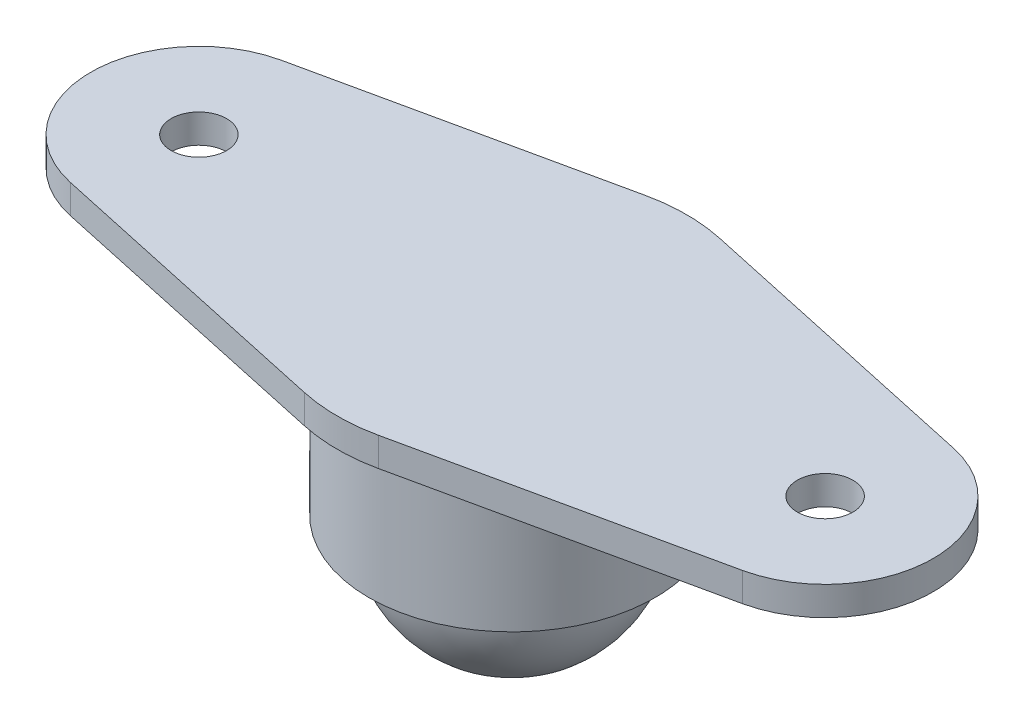
from build123d import *

# Parameters (mm, degrees)
SKETCH1_R           = 1.925
BOSS_EXTRUDE1_DEPTH = 2
SKETCH3_R           = 9.925
SKETCH3_R_2         = 7.925
BOSS_EXTRUDE2_DEPTH = 10


with BuildPart() as part:
    # Sketch1 → Boss-Extrude1 (new body)
    with BuildSketch(Plane(origin=(0, 0, 0), x_dir=(1, 0, 0), z_dir=(0, 1, 0))):
        with BuildLine():
            Line((-23.311850829, 7.329120748), (-2.570308471, 11.834086968))
            ThreePointArc((-2.570308471, 11.834086968), (0, 12.11), (2.570308471, 11.834086968))
            Line((2.570308471, 11.834086968), (23.311850829, 7.329120748))
            ThreePointArc((23.311850829, 7.329120748), (29.22, 0), (23.311850829, -7.329120748))
            Line((23.311850829, -7.329120748), (2.570308471, -11.834086968))
            ThreePointArc((2.570308471, -11.834086968), (0, -12.11), (-2.570308471, -11.834086968))
            Line((-2.570308471, -11.834086968), (-23.311850829, -7.329120748))
            ThreePointArc((-23.311850829, -7.329120748), (-29.22, 0), (-23.311850829, 7.329120748))
        make_face()
        with Locations(Location((-21.72, 0, 0), (0, 0, 270))):
            Circle(SKETCH1_R, mode=Mode.SUBTRACT)
        with Locations(Location((21.72, 0, 0), (0, 0, 90))):
            Circle(SKETCH1_R, mode=Mode.SUBTRACT)
    extrude(amount=BOSS_EXTRUDE1_DEPTH)

    # Sketch3 → Boss-Extrude2 (add)
    with BuildSketch(Plane.XZ):
        with Locations(Location((0, 0, 0), (0, 0, 90))):
            Circle(SKETCH3_R)
        with Locations(Location((0, 0, 0), (0, 0, 270))):
            Circle(SKETCH3_R_2, mode=Mode.SUBTRACT)
    extrude(amount=BOSS_EXTRUDE2_DEPTH)


with BuildPart() as body_2:
    # Sketch2 → Revolve2 (revolve)
    with BuildSketch(Plane(origin=(0, 0, 0), x_dir=(0, 0, -1), z_dir=(1, 0, 0))):
        with BuildLine():
            Line((0, -2.15), (0, -18))
            ThreePointArc((0, -18), (7.925, -10.075), (0, -2.15))
        make_face()
    revolve(axis=Axis((0, -2.15, 0), (0, -1, 0)))


solid = Compound([part.part, body_2.part])
